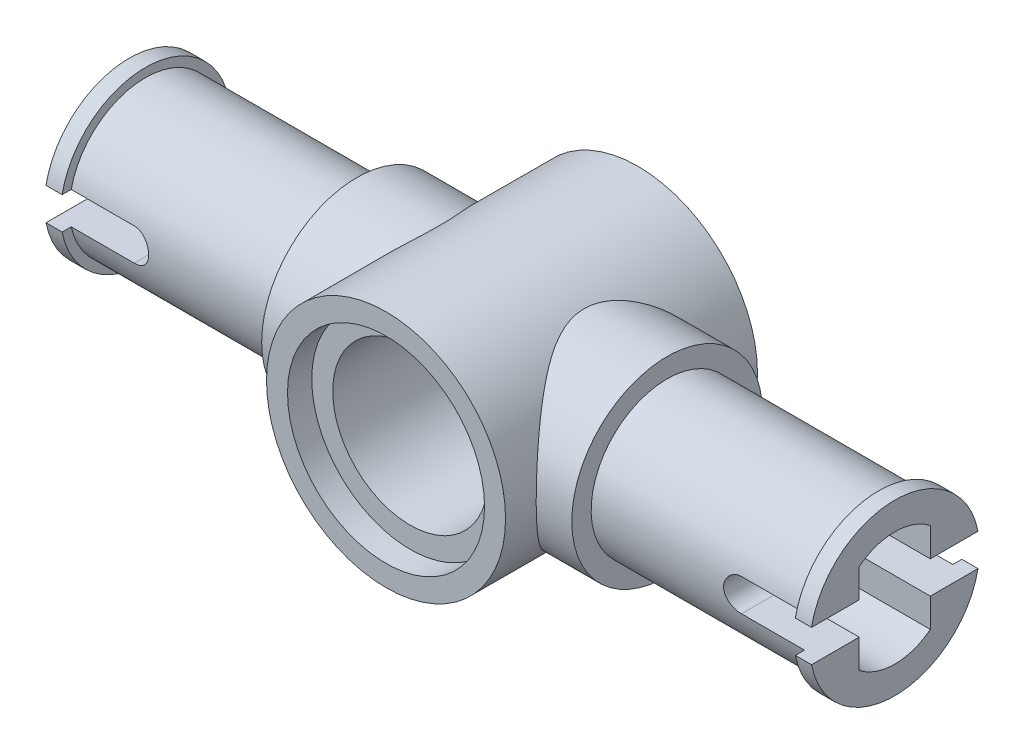
from build123d import *

# Parameters (mm, degrees)
SKETCH1_R              = 2.35
PIN_DEPTH              = 11.35
SKETCH2_R              = 2.95
MIDDLE_DEPTH           = 4.8
SKETCH3_R              = 2.625
OUTER_RIM_DEPTH        = 0.5
BORE_CUT_DEPTH         = 13.562941535
BORE_CUT_DEPTH_BACK    = 13.562941535
SLOT_CUT_DEPTH         = 13.562941535
SLOT_CUT_DEPTH_BACK    = 13.562941535
SKETCH6_R              = 3.7
MIDDLE_BODY_DEPTH      = 3.9
MIDDLE_BORE_DEPTH      = 14.012398084
MIDDLE_BORE_DEPTH_BACK = 14.012398084
SKETCH7_R              = 2.4
SKETCH8_R              = 3.05
MIDDLE_RIM_CUT_DEPTH   = 0.75


with BuildPart() as part:
    # Sketch1 → Pin (new, symmetric)
    with BuildSketch(Plane(origin=(0, 0, 0), x_dir=(0, 0, -1), z_dir=(1, 0, 0))):
        Circle(SKETCH1_R)
    extrude(amount=PIN_DEPTH, both=True)

    # Sketch2 → Middle (add, symmetric)
    with BuildSketch(Plane(origin=(0, 0, 0), x_dir=(0, 0, -1), z_dir=(1, 0, 0))):
        Circle(SKETCH2_R)
    extrude(amount=MIDDLE_DEPTH, both=True)

    # Sketch3 → Outer Rim (add)
    with BuildSketch(Plane(origin=(11.35, 0, 0), x_dir=(0, 0, -1), z_dir=(1, 0, 0))):
        Circle(SKETCH3_R)
    outer_rim = extrude(amount=OUTER_RIM_DEPTH)

    # Mirror1: Outer Rim across plane
    add(outer_rim.mirror(Plane(origin=(0, 0, 0), x_dir=(0, 0, 1), z_dir=(1, 0, 0))))

    # Sketch4 → Bore Cut (cut, two sides: drawn at the far end of the back side and taken through both)
    with BuildSketch(Plane(origin=(0, 0, 0), x_dir=(0, 0, -1), z_dir=(1, 0, 0)).offset(-BORE_CUT_DEPTH_BACK)):
        with BuildLine():
            ThreePointArc((-1.1, -1.393063172), (0, -1.775), (1.1, -1.393063172))
            Line((1.1, -1.393063172), (1.1, 1.393063172))
            ThreePointArc((1.1, 1.393063172), (0, 1.775), (-1.1, 1.393063172))
            Line((-1.1, 1.393063172), (-1.1, -1.393063172))
        make_face()
    extrude(amount=BORE_CUT_DEPTH + BORE_CUT_DEPTH_BACK, mode=Mode.SUBTRACT)

    # Sketch5 → Slot Cut (cut, two sides: drawn at the far end of the back side and taken through both)
    with BuildSketch(Plane.XY.offset(-SLOT_CUT_DEPTH_BACK)):
        with BuildLine():
            Line((14.3, -0.5), (9.4, -0.5))
            ThreePointArc((9.4, -0.5), (8.9, 0), (9.4, 0.5))
            Line((9.4, 0.5), (14.3, 0.5))
            ThreePointArc((14.3, 0.5), (14.8, 0), (14.3, -0.5))
        make_face()
        with BuildLine():
            Line((-14.3, -0.5), (-9.4, -0.5))
            ThreePointArc((-9.4, -0.5), (-8.9, 0), (-9.4, 0.5))
            Line((-9.4, 0.5), (-14.3, 0.5))
            ThreePointArc((-14.3, 0.5), (-14.8, 0), (-14.3, -0.5))
        make_face()
    extrude(amount=SLOT_CUT_DEPTH + SLOT_CUT_DEPTH_BACK, mode=Mode.SUBTRACT)

    # Sketch6 → Middle Body (add, symmetric)
    with BuildSketch(Plane.XY):
        Circle(SKETCH6_R)
    extrude(amount=MIDDLE_BODY_DEPTH, both=True)

    # Sketch7 → Middle Bore (cut, two sides: drawn at the far end of the back side and taken through both)
    with BuildSketch(Plane.XY.offset(-MIDDLE_BORE_DEPTH_BACK)):
        Circle(SKETCH7_R)
    extrude(amount=MIDDLE_BORE_DEPTH + MIDDLE_BORE_DEPTH_BACK, mode=Mode.SUBTRACT)

    # Sketch8 → Middle Rim Cut (cut)
    with BuildSketch(Plane.XY.offset(3.9)):
        Circle(SKETCH8_R)
    middle_rim_cut = extrude(amount=-MIDDLE_RIM_CUT_DEPTH, mode=Mode.SUBTRACT)

    # Mirror2: Middle Rim Cut across plane
    add(middle_rim_cut.mirror(Plane.XY), mode=Mode.SUBTRACT)


solid = part.part
